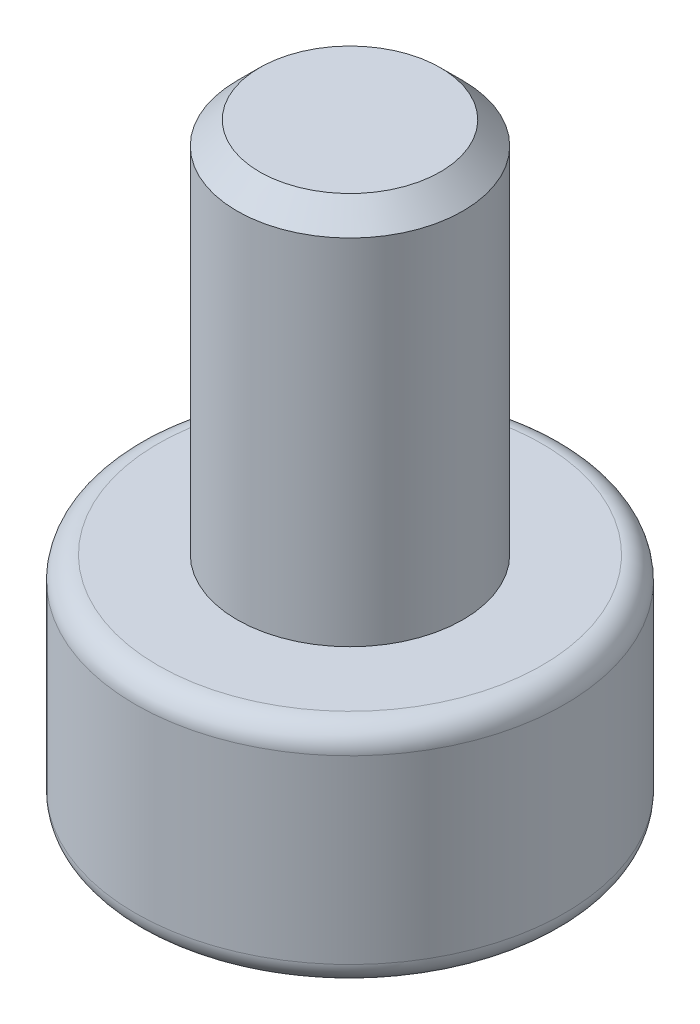
from build123d import *

# Parameters (mm, degrees)
SKETCH_1_R          = 2.85
EXTRUDE_1_DEPTH     = 3
SKETCH_2_R          = 1.5
EXTRUDE_2_DEPTH     = 5
SKETCH_3_R          = 1.29
CUT_EXTRUDE_1_DEPTH = 1.3
FILLET_1_R          = 0.3
CHAMFER_1_SIZE      = 0.3
CHAMFER_2_SIZE      = 0.15


with BuildPart() as part:
    # 草图1 → 凸台-拉伸1 (new body)
    with BuildSketch(Plane(origin=(0, 0, 0), x_dir=(1, 0, 0), z_dir=(0, 1, 0))):
        with Locations(Location((0, 0, 0), (0, 0, 270))):
            Circle(SKETCH_1_R)
    extrude(amount=EXTRUDE_1_DEPTH)

    # 草图2 → 凸台-拉伸2 (add)
    with BuildSketch(Plane(origin=(0, 3, 0), x_dir=(1, 0, 0), z_dir=(0, 1, 0))):
        with Locations(Location((0, 0, 0), (0, 0, 270))):
            Circle(SKETCH_2_R)
    extrude(amount=EXTRUDE_2_DEPTH)

    # 草图3 → 切除-拉伸1 (cut)
    with BuildSketch(Plane.XZ):
        with Locations(Location((0, 0, 0), (0, 0, 270))):
            Circle(SKETCH_3_R)
    extrude(amount=-CUT_EXTRUDE_1_DEPTH, mode=Mode.SUBTRACT)

    # 圆角1
    fillet_1_edges = [part.edges().sort_by_distance(p)[0] for p in [
        (0, 0, -2.85),
        (0, 3, -2.85),
    ]]
    fillet(fillet_1_edges, radius=FILLET_1_R)

    # 倒角1
    chamfer_1_edges = [part.edges().sort_by_distance(p)[0] for p in [
        (0, 8, -1.5),
    ]]
    chamfer(chamfer_1_edges, length=CHAMFER_1_SIZE)

    # 倒角2
    chamfer_2_edges = [part.edges().sort_by_distance(p)[0] for p in [
        (0, 0, 1.29),
    ]]
    chamfer(chamfer_2_edges, length=CHAMFER_2_SIZE)


solid = part.part
